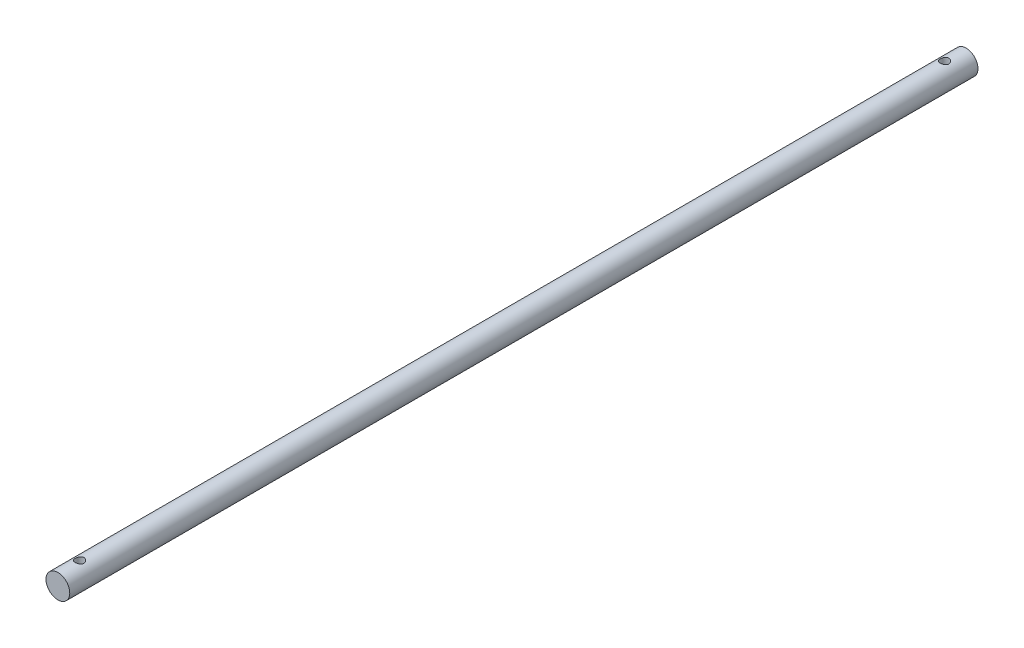
from build123d import *

# Parameters (mm, degrees)
SKETCH1_R               = 2.75
BOSS_EXTRUDE1_DEPTH     = 210
CUT_EXTRUDE1_DEPTH      = 211.036008818
CUT_EXTRUDE1_DEPTH_BACK = 211.036008818
SKETCH2_R               = 1
CUT_EXTRUDE2_DEPTH      = 211.03600892
CUT_EXTRUDE2_DEPTH_BACK = 211.03600892
SKETCH3_R               = 1


with BuildPart() as part:
    # Sketch1 → Boss-Extrude1 (new body)
    with BuildSketch(Plane.XY):
        Circle(SKETCH1_R)
    extrude(amount=BOSS_EXTRUDE1_DEPTH)

    # Sketch2 → Cut-Extrude1 (cut, two sides: drawn at the far end of the back side and taken through both)
    with BuildSketch(Plane(origin=(0, 0, 0), x_dir=(1, 0, 0), z_dir=(0, 1, 0)).offset(-CUT_EXTRUDE1_DEPTH_BACK)):
        with Locations(Location((0, -5, 0), (0, 0, 270))):
            Circle(SKETCH2_R)
    extrude(amount=CUT_EXTRUDE1_DEPTH + CUT_EXTRUDE1_DEPTH_BACK, mode=Mode.SUBTRACT)

    # Sketch3 → Cut-Extrude2 (cut, two sides: drawn at the far end of the back side and taken through both)
    with BuildSketch(Plane(origin=(0, 0, 0), x_dir=(1, 0, 0), z_dir=(0, 1, 0)).offset(-CUT_EXTRUDE2_DEPTH_BACK)):
        with Locations(Location((0, -205, 0), (0, 0, 270))):
            Circle(SKETCH3_R)
    extrude(amount=CUT_EXTRUDE2_DEPTH + CUT_EXTRUDE2_DEPTH_BACK, mode=Mode.SUBTRACT)


solid = part.part
